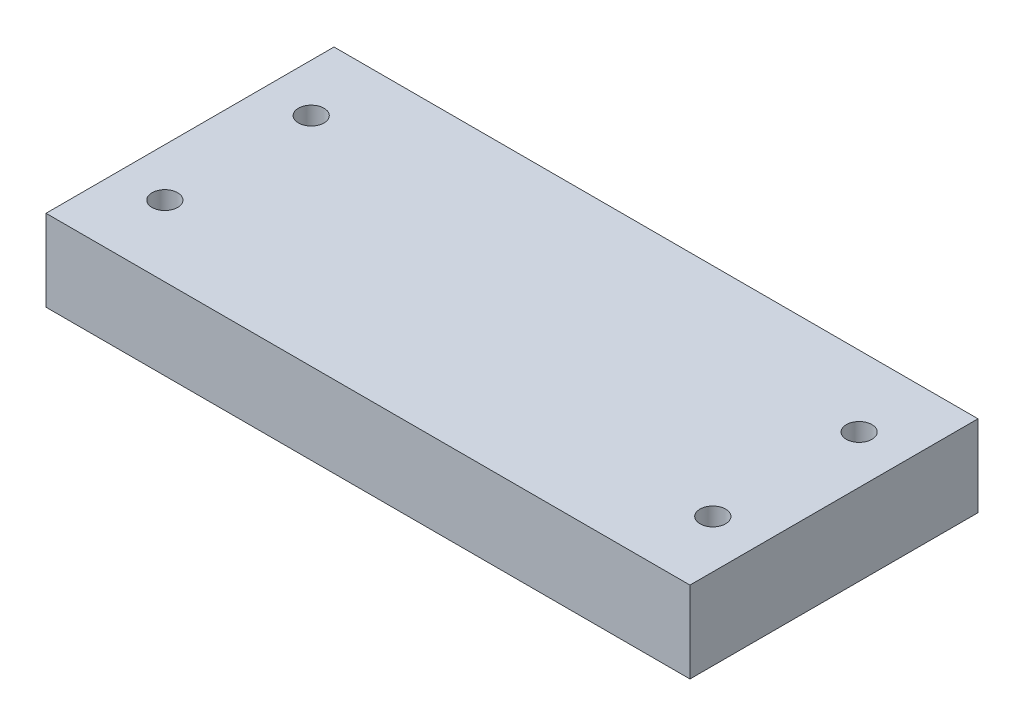
from build123d import *

# Parameters (mm, degrees)
SKETCH1_W            = 139.7
SKETCH1_H            = 62.484
BOSS_EXTRUDE1_DEPTH  = 17.653
SKETCH2_R            = 2.778125
CUT_EXTRUDE1_DEPTH   = 79.528424618
LPATTERN1_COUNT      = 2
LPATTERN1_PITCH      = 31.75
LPATTERN1_COUNT_DIR2 = 2
LPATTERN1_PITCH_DIR2 = 118.872


with BuildPart() as part:
    # Sketch1 → Boss-Extrude1 (new body)
    with BuildSketch(Plane(origin=(0, 0, 0), x_dir=(1, 0, 0), z_dir=(0, 1, 0))):
        Rectangle(SKETCH1_W, SKETCH1_H)
    extrude(amount=BOSS_EXTRUDE1_DEPTH)

    # Sketch2 → Cut-Extrude1 (cut, through all)
    with BuildSketch(Plane(origin=(0, 17.653, 0), x_dir=(1, 0, 0), z_dir=(0, 1, 0))):
        with Locations(Location((-59.436, -15.875, 0), (0, 0, 270))):
            Circle(SKETCH2_R)
    cut_extrude1 = extrude(amount=-CUT_EXTRUDE1_DEPTH, mode=Mode.SUBTRACT)

    # LPattern1: Cut-Extrude1 2 × 2
    with Locations(*[(j * LPATTERN1_PITCH_DIR2, 0, -i * LPATTERN1_PITCH) for i in range(LPATTERN1_COUNT) for j in range(LPATTERN1_COUNT_DIR2) if (i, j) != (0, 0)]):
        add(cut_extrude1, mode=Mode.SUBTRACT)


solid = part.part
